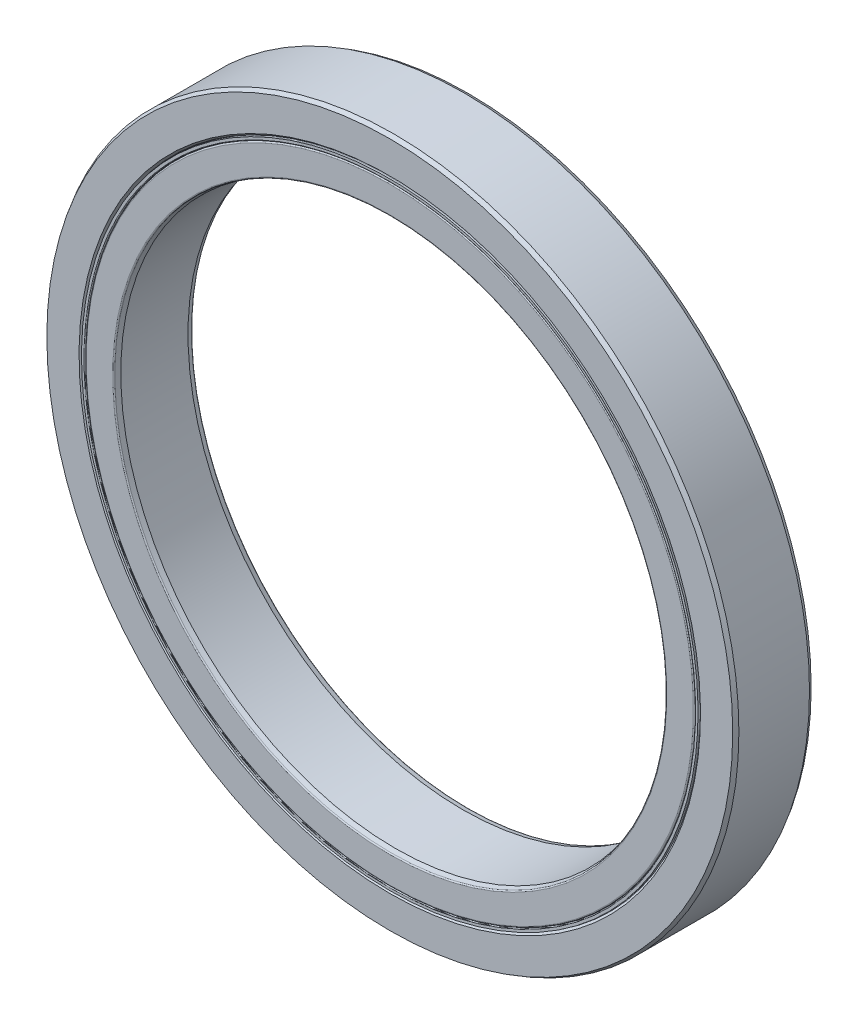
from build123d import *

# Parameters (mm, degrees)
CIRPATTERN1_COUNT = 23


with BuildPart() as part:
    # Sketch3 → Revolve1 (revolve)
    with BuildSketch(Plane(origin=(0, 0, 0), x_dir=(0, 0, -1), z_dir=(1, 0, 0)), mode=Mode.PRIVATE) as revolve1_sk:
        with BuildLine():
            Line((-2.103734106, 19.58), (-2.375, 19.678732711))
            Line((-2.375, 19.678732711), (-2.5, 19.803732711))
            Line((-2.5, 19.803732711), (-2.5, 21.855662433))
            Line((-2.5, 21.855662433), (-2.25, 22))
            Line((-2.25, 22), (2.25, 22))
            Line((2.25, 22), (2.5, 21.855662433))
            Line((2.5, 21.855662433), (2.5, 19.803732711))
            Line((2.5, 19.803732711), (2.375, 19.678732711))
            Line((2.375, 19.678732711), (2.103734106, 19.58))
            Line((2.103734106, 19.58), (1.685869377, 19.58))
            ThreePointArc((1.685869377, 19.58), (0, 21.193333333), (-1.685869377, 19.58))
            Line((-1.685869377, 19.58), (-2.103734106, 19.58))
        make_face()
    revolve(revolve1_sk.sketch.rotate(Axis((0, 0, 2.5), (0, 0, -1)), 180), axis=Axis((0, 0, 2.5), (0, 0, -1)))


with BuildPart() as body_2:
    # Sketch4 → Revolve2 (revolve)
    with BuildSketch(Plane(origin=(0, 0, 0), x_dir=(0, 0, -1), z_dir=(1, 0, 0)), mode=Mode.PRIVATE) as revolve2_sk:
        with BuildLine():
            Line((-2.141924517, 17.5), (-2.438933561, 17.579583333))
            ThreePointArc((-2.438933561, 17.579583333), (-2.482974231, 17.609010369), (-2.5, 17.659166667))
            Line((-2.5, 17.659166667), (-2.5, 19.349275937))
            ThreePointArc((-2.5, 19.349275937), (-2.475868314, 19.407534981), (-2.417609271, 19.431666667))
            Line((-2.417609271, 19.431666667), (-1.685869377, 19.431666667))
            ThreePointArc((-1.685869377, 19.431666667), (0, 17.818333333), (1.685869377, 19.431666667))
            Line((1.685869377, 19.431666667), (2.417609271, 19.431666667))
            ThreePointArc((2.417609271, 19.431666667), (2.475868314, 19.407534981), (2.5, 19.349275937))
            Line((2.5, 19.349275937), (2.5, 17.659166667))
            ThreePointArc((2.5, 17.659166667), (2.482974231, 17.609010369), (2.438933561, 17.579583333))
            Line((2.438933561, 17.579583333), (2.141924517, 17.5))
            Line((2.141924517, 17.5), (-2.141924517, 17.5))
        make_face()
    revolve(revolve2_sk.sketch.rotate(Axis((0, 0, 2.5), (0, 0, -1)), 180), axis=Axis((0, 0, 2.5), (0, 0, -1)))


with BuildPart() as body_3:
    # Sketch5 → Revolve3 (revolve)
    with BuildSketch(Plane(origin=(0, 0, 0), x_dir=(0, 0, -1), z_dir=(1, 0, 0))):
        with BuildLine():
            Line((-1.6875, 19.505833333), (1.6875, 19.505833333))
            ThreePointArc((1.6875, 19.505833333), (0, 21.193333333), (-1.6875, 19.505833333))
        make_face()
    revolve(axis=Axis((0, 19.505833333, 1.6875), (0, 0, -1)))


with BuildPart() as cirpattern1_1:
    # CirPattern1: pattern copy
    add(body_3.part.rotate(Axis((0, 0, 0), (0, 0, 1)), 1 * 360 / CIRPATTERN1_COUNT))


with BuildPart() as cirpattern1_2:
    # CirPattern1: pattern copy
    add(body_3.part.rotate(Axis((0, 0, 0), (0, 0, 1)), 2 * 360 / CIRPATTERN1_COUNT))


with BuildPart() as cirpattern1_3:
    # CirPattern1: pattern copy
    add(body_3.part.rotate(Axis((0, 0, 0), (0, 0, 1)), 3 * 360 / CIRPATTERN1_COUNT))


with BuildPart() as cirpattern1_4:
    # CirPattern1: pattern copy
    add(body_3.part.rotate(Axis((0, 0, 0), (0, 0, 1)), 4 * 360 / CIRPATTERN1_COUNT))


with BuildPart() as cirpattern1_5:
    # CirPattern1: pattern copy
    add(body_3.part.rotate(Axis((0, 0, 0), (0, 0, 1)), 5 * 360 / CIRPATTERN1_COUNT))


with BuildPart() as cirpattern1_6:
    # CirPattern1: pattern copy
    add(body_3.part.rotate(Axis((0, 0, 0), (0, 0, 1)), 6 * 360 / CIRPATTERN1_COUNT))


with BuildPart() as cirpattern1_7:
    # CirPattern1: pattern copy
    add(body_3.part.rotate(Axis((0, 0, 0), (0, 0, 1)), 7 * 360 / CIRPATTERN1_COUNT))


with BuildPart() as cirpattern1_8:
    # CirPattern1: pattern copy
    add(body_3.part.rotate(Axis((0, 0, 0), (0, 0, 1)), 8 * 360 / CIRPATTERN1_COUNT))


with BuildPart() as cirpattern1_9:
    # CirPattern1: pattern copy
    add(body_3.part.rotate(Axis((0, 0, 0), (0, 0, 1)), 9 * 360 / CIRPATTERN1_COUNT))


with BuildPart() as cirpattern1_10:
    # CirPattern1: pattern copy
    add(body_3.part.rotate(Axis((0, 0, 0), (0, 0, 1)), 10 * 360 / CIRPATTERN1_COUNT))


with BuildPart() as cirpattern1_11:
    # CirPattern1: pattern copy
    add(body_3.part.rotate(Axis((0, 0, 0), (0, 0, 1)), 11 * 360 / CIRPATTERN1_COUNT))


with BuildPart() as cirpattern1_12:
    # CirPattern1: pattern copy
    add(body_3.part.rotate(Axis((0, 0, 0), (0, 0, 1)), 12 * 360 / CIRPATTERN1_COUNT))


with BuildPart() as cirpattern1_13:
    # CirPattern1: pattern copy
    add(body_3.part.rotate(Axis((0, 0, 0), (0, 0, 1)), 13 * 360 / CIRPATTERN1_COUNT))


with BuildPart() as cirpattern1_14:
    # CirPattern1: pattern copy
    add(body_3.part.rotate(Axis((0, 0, 0), (0, 0, 1)), 14 * 360 / CIRPATTERN1_COUNT))


with BuildPart() as cirpattern1_15:
    # CirPattern1: pattern copy
    add(body_3.part.rotate(Axis((0, 0, 0), (0, 0, 1)), 15 * 360 / CIRPATTERN1_COUNT))


with BuildPart() as cirpattern1_16:
    # CirPattern1: pattern copy
    add(body_3.part.rotate(Axis((0, 0, 0), (0, 0, 1)), 16 * 360 / CIRPATTERN1_COUNT))


with BuildPart() as cirpattern1_17:
    # CirPattern1: pattern copy
    add(body_3.part.rotate(Axis((0, 0, 0), (0, 0, 1)), 17 * 360 / CIRPATTERN1_COUNT))


with BuildPart() as cirpattern1_18:
    # CirPattern1: pattern copy
    add(body_3.part.rotate(Axis((0, 0, 0), (0, 0, 1)), 18 * 360 / CIRPATTERN1_COUNT))


with BuildPart() as cirpattern1_19:
    # CirPattern1: pattern copy
    add(body_3.part.rotate(Axis((0, 0, 0), (0, 0, 1)), 19 * 360 / CIRPATTERN1_COUNT))


with BuildPart() as cirpattern1_20:
    # CirPattern1: pattern copy
    add(body_3.part.rotate(Axis((0, 0, 0), (0, 0, 1)), 20 * 360 / CIRPATTERN1_COUNT))


with BuildPart() as cirpattern1_21:
    # CirPattern1: pattern copy
    add(body_3.part.rotate(Axis((0, 0, 0), (0, 0, 1)), 21 * 360 / CIRPATTERN1_COUNT))


with BuildPart() as cirpattern1_22:
    # CirPattern1: pattern copy
    add(body_3.part.rotate(Axis((0, 0, 0), (0, 0, 1)), 22 * 360 / CIRPATTERN1_COUNT))


with BuildPart() as body_26:
    # Sketch6 → Revolve4 (revolve)
    with BuildSketch(Plane(origin=(0, 0, 0), x_dir=(0, 0, -1), z_dir=(1, 0, 0)), mode=Mode.PRIVATE) as revolve4_sk:
        with BuildLine():
            Line((-2.344115427, 19.58), (-1.6875, 19.58))
            Line((-1.6875, 19.58), (-1.6875, 19.611666667))
            Line((-1.6875, 19.611666667), (-2.464, 19.611666667))
            ThreePointArc((-2.464, 19.611666667), (-2.489455844, 19.622210823), (-2.5, 19.647666667))
            Line((-2.5, 19.647666667), (-2.5, 19.49))
            Line((-2.5, 19.49), (-2.344115427, 19.58))
        make_face()
        with BuildLine():
            Line((2.464, 19.611666667), (1.6875, 19.611666667))
            Line((1.6875, 19.611666667), (1.6875, 19.58))
            Line((1.6875, 19.58), (2.344115427, 19.58))
            Line((2.344115427, 19.58), (2.5, 19.49))
            Line((2.5, 19.49), (2.5, 19.647666667))
            ThreePointArc((2.5, 19.647666667), (2.489455844, 19.622210823), (2.464, 19.611666667))
        make_face()
    revolve(revolve4_sk.sketch.rotate(Axis((0, 0, 2.5), (0, 0, -1)), 180), axis=Axis((0, 0, 2.5), (0, 0, -1)))


with BuildPart() as body_27:
    # Sketch7 → Revolve5 (revolve)
    with BuildSketch(Plane(origin=(0, 0, 0), x_dir=(0, 0, -1), z_dir=(1, 0, 0)), mode=Mode.PRIVATE) as revolve5_sk:
        with BuildLine():
            Line((-1.6875, 19.611666667), (-2.36643699, 19.611666667))
            Line((-2.36643699, 19.611666667), (-2.410753339, 19.603852499))
            ThreePointArc((-2.410753339, 19.603852499), (-2.426163938, 19.583769015), (-2.4075, 19.566666667))
            Line((-2.4075, 19.566666667), (-2.4325, 19.566666667))
            ThreePointArc((-2.4325, 19.566666667), (-2.5, 19.499166667), (-2.4325, 19.431666667))
            Line((-2.4325, 19.431666667), (-1.6875, 19.431666667))
            Line((-1.6875, 19.431666667), (-1.6875, 19.611666667))
        make_face()
    revolve(revolve5_sk.sketch.rotate(Axis((0, 0, 2.5), (0, 0, -1)), 180), axis=Axis((0, 0, 2.5), (0, 0, -1)))


solid = Compound([part.part, body_2.part, body_3.part, cirpattern1_1.part, cirpattern1_2.part, cirpattern1_3.part, cirpattern1_4.part, cirpattern1_5.part, cirpattern1_6.part, cirpattern1_7.part, cirpattern1_8.part, cirpattern1_9.part, cirpattern1_10.part, cirpattern1_11.part, cirpattern1_12.part, cirpattern1_13.part, cirpattern1_14.part, cirpattern1_15.part, cirpattern1_16.part, cirpattern1_17.part, cirpattern1_18.part, cirpattern1_19.part, cirpattern1_20.part, cirpattern1_21.part, cirpattern1_22.part, body_26.part, body_27.part])
